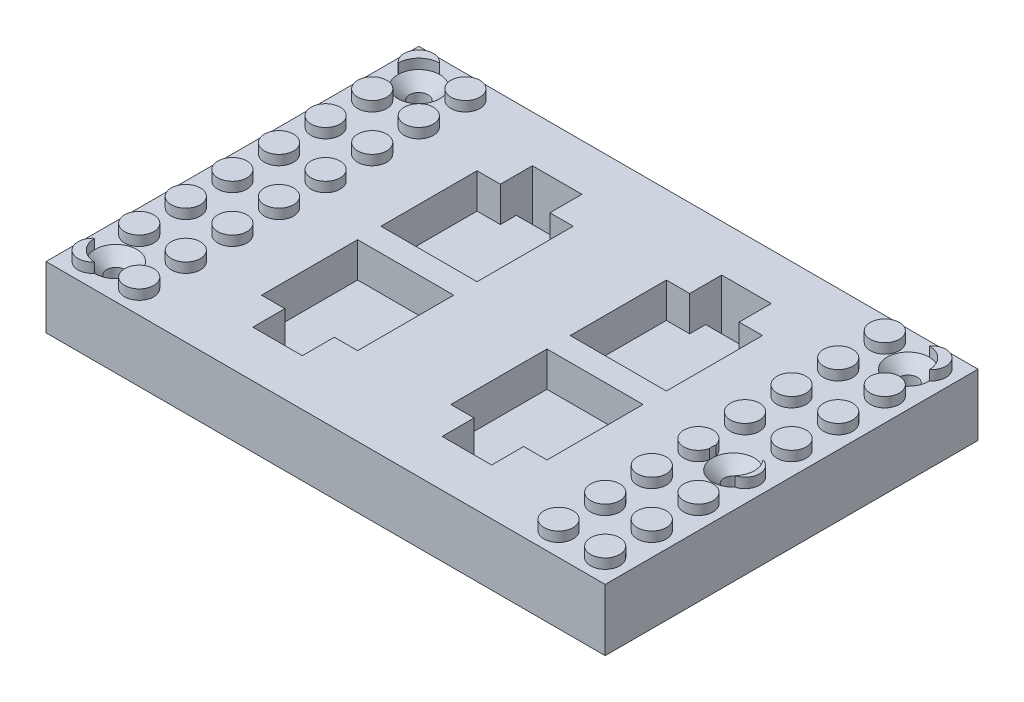
from build123d import *

# Parameters (mm, degrees)
SKETCH1_W           = 96
SKETCH1_H           = 64
BOSS_EXTRUDE1_DEPTH = 10.6
CUT_EXTRUDE1_DEPTH  = 6
SKETCH3_W           = 8.5
SKETCH3_H           = 2.75
CUT_EXTRUDE2_DEPTH  = 59
SKETCH4_R           = 1.6
CUT_EXTRUDE3_DEPTH  = 59.654582089
CHAMFER1_SIZE       = 2
SKETCH5_R           = 2.5
BOSS_EXTRUDE3_DEPTH = 1.7
SKETCH6_R           = 3.6
CUT_EXTRUDE5_DEPTH  = 59.654582089


with BuildPart() as part:
    # Sketch1 → Boss-Extrude1 (new body)
    with BuildSketch(Plane(origin=(0, 0, 0), x_dir=(1, 0, 0), z_dir=(0, 1, 0))):
        Rectangle(SKETCH1_W, SKETCH1_H)
    extrude(amount=BOSS_EXTRUDE1_DEPTH)

    # Sketch2 → Cut-Extrude1 (cut)
    with BuildSketch(Plane(origin=(0, 10.6, 0), x_dir=(1, 0, 0), z_dir=(0, 1, 0))):
        Polygon((-20.5, 18.5), (-20.5, 24), (-12, 24), (-12, 18.5), (-8, 18.5), (-8, 2), (-24.5, 2), (-24.5, 18.5), align=None)
        Polygon((-24.5, -2), (-8, -2), (-8, -18.5), (-12, -18.5), (-12, -24), (-20.5, -24), (-20.5, -18.5), (-24.5, -18.5), align=None)
        Polygon((24.5, -2), (24.5, -18.5), (20.5, -18.5), (20.5, -24), (12, -24), (12, -18.5), (8, -18.5), (8, -2), align=None)
        Polygon((24.5, 2), (8, 2), (8, 18.5), (12, 18.5), (12, 24), (20.5, 24), (20.5, 18.5), (24.5, 18.5), align=None)
    extrude(amount=-CUT_EXTRUDE1_DEPTH, mode=Mode.SUBTRACT)

    # Sketch3 → Cut-Extrude2 (cut, through all)
    with BuildSketch(Plane(origin=(0, 4.6, 0), x_dir=(1, 0, 0), z_dir=(0, 1, 0))):
        with Locations((-16.25, 22.625)):
            Rectangle(SKETCH3_W, SKETCH3_H)
        with Locations((16.25, 22.625)):
            Rectangle(SKETCH3_W, SKETCH3_H)
        with Locations((-16.25, -22.625)):
            Rectangle(SKETCH3_W, SKETCH3_H)
        with Locations((16.25, -22.625)):
            Rectangle(SKETCH3_W, SKETCH3_H)
    extrude(amount=-CUT_EXTRUDE2_DEPTH, mode=Mode.SUBTRACT)

    # Sketch4 → Cut-Extrude3 (cut, through all)
    with BuildSketch(Plane(origin=(0, 10.6, 0), x_dir=(1, 0, 0), z_dir=(0, 1, 0))):
        with Locations(Location((-42, 26, 0), (0, 0, 270))):
            Circle(SKETCH4_R)
        with Locations(Location((42, 26, 0), (0, 0, 90))):
            Circle(SKETCH4_R)
        with Locations(Location((-42, -26, 0), (0, 0, 90))):
            Circle(SKETCH4_R)
        with Locations(Location((42, -4, 0), (0, 0, 270))):
            Circle(SKETCH4_R)
    extrude(amount=-CUT_EXTRUDE3_DEPTH, mode=Mode.SUBTRACT)

    # Chamfer1
    chamfer1_edges = [part.edges().sort_by_distance(p)[0] for p in [
        (42, 10.6, -24.4),
        (-42, 10.6, 27.6),
        (42, 10.6, 2.4),
        (-42, 10.6, -27.6),
    ]]
    chamfer(chamfer1_edges, length=CHAMFER1_SIZE)

    # Sketch5 → Boss-Extrude3 (add)
    with BuildSketch(Plane(origin=(0, 10.6, 0), x_dir=(1, 0, 0), z_dir=(0, 1, 0))):
        with Locations(Location((-44, 28, 0), (0, 0, 39.766388891))):
            Circle(SKETCH5_R)
        with Locations(Location((-36, 28, 0), (0, 0, 90))):
            Circle(SKETCH5_R)
        with Locations(Location((-44, 20, 0), (0, 0, 90))):
            Circle(SKETCH5_R)
        with Locations(Location((-36, 20, 0), (0, 0, 90))):
            Circle(SKETCH5_R)
        with Locations(Location((-44, 12, 0), (0, 0, 90))):
            Circle(SKETCH5_R)
        with Locations(Location((-36, 12, 0), (0, 0, 90))):
            Circle(SKETCH5_R)
        with Locations(Location((-44, 4, 0), (0, 0, 90))):
            Circle(SKETCH5_R)
        with Locations(Location((-36, 4, 0), (0, 0, 90))):
            Circle(SKETCH5_R)
        with Locations(Location((-44, -4, 0), (0, 0, 90))):
            Circle(SKETCH5_R)
        with Locations(Location((-36, -4, 0), (0, 0, 90))):
            Circle(SKETCH5_R)
        with Locations(Location((36, -4, 0), (0, 0, 90))):
            Circle(SKETCH5_R)
        with Locations(Location((44, -4, 0), (0, 0, 90))):
            Circle(SKETCH5_R)
        with Locations(Location((44, 4, 0), (0, 0, 90))):
            Circle(SKETCH5_R)
        with Locations(Location((36, 4, 0), (0, 0, 90))):
            Circle(SKETCH5_R)
        with Locations(Location((36, 12, 0), (0, 0, 90))):
            Circle(SKETCH5_R)
        with Locations(Location((44, 12, 0), (0, 0, 90))):
            Circle(SKETCH5_R)
        with Locations(Location((44, 20, 0), (0, 0, 90))):
            Circle(SKETCH5_R)
        with Locations(Location((36, 20, 0), (0, 0, 90))):
            Circle(SKETCH5_R)
        with Locations(Location((36, 28, 0), (0, 0, 90))):
            Circle(SKETCH5_R)
        with Locations(Location((44, 28, 0), (0, 0, 90))):
            Circle(SKETCH5_R)
        with Locations(Location((-44, -12, 0), (0, 0, 90))):
            Circle(SKETCH5_R)
        with Locations(Location((-36, -12, 0), (0, 0, 90))):
            Circle(SKETCH5_R)
        with Locations(Location((-44, -20, 0), (0, 0, 90))):
            Circle(SKETCH5_R)
        with Locations(Location((-36, -20, 0), (0, 0, 90))):
            Circle(SKETCH5_R)
        with Locations(Location((-44, -28, 0), (0, 0, 129.766388891))):
            Circle(SKETCH5_R)
        with Locations(Location((-36, -28, 0), (0, 0, 90))):
            Circle(SKETCH5_R)
        with Locations(Location((36, -28, 0), (0, 0, 90))):
            Circle(SKETCH5_R)
        with Locations(Location((36, -20, 0), (0, 0, 90))):
            Circle(SKETCH5_R)
        with Locations(Location((36, -12, 0), (0, 0, 90))):
            Circle(SKETCH5_R)
        with Locations(Location((44, -12, 0), (0, 0, 90))):
            Circle(SKETCH5_R)
        with Locations(Location((44, -20, 0), (0, 0, 90))):
            Circle(SKETCH5_R)
        with Locations(Location((44, -28, 0), (0, 0, 90))):
            Circle(SKETCH5_R)
    extrude(amount=BOSS_EXTRUDE3_DEPTH)

    # Sketch6 → Cut-Extrude5 (cut, through all)
    with BuildSketch(Plane(origin=(0, 10.6, 0), x_dir=(1, 0, 0), z_dir=(0, 1, 0))):
        with Locations((-42, 26)):
            Circle(SKETCH6_R)
        with Locations((-42, -26)):
            Circle(SKETCH6_R)
        with Locations((42, -4)):
            Circle(SKETCH6_R)
        with Locations((42, 26)):
            Circle(SKETCH6_R)
    extrude(amount=CUT_EXTRUDE5_DEPTH, mode=Mode.SUBTRACT)


solid = part.part
